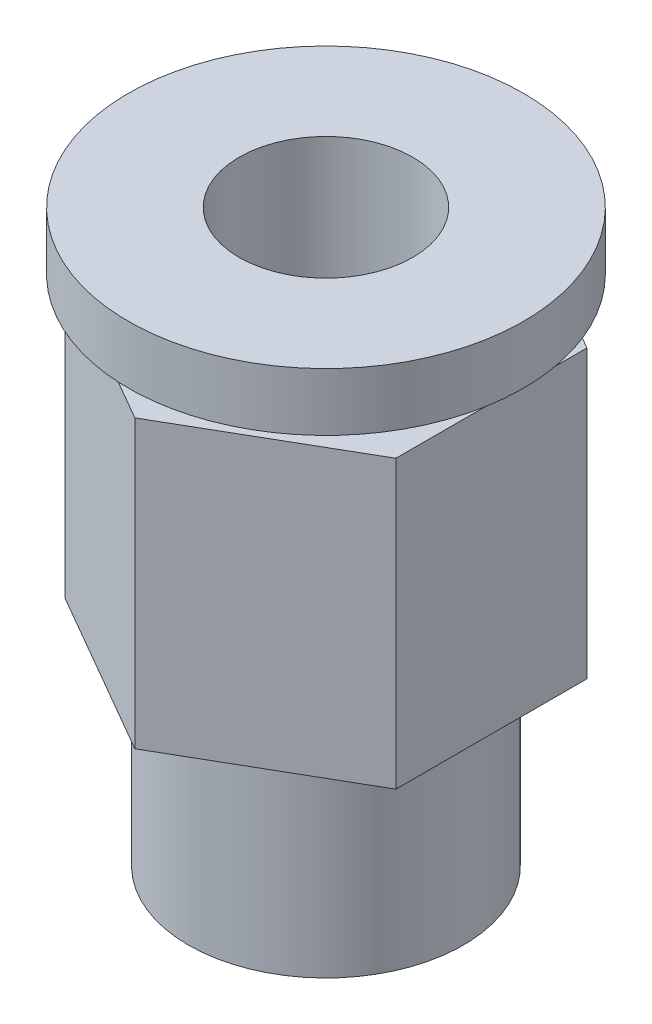
from build123d import *

# Parameters (mm, degrees)
CUT_EXTRUDE1_REACH = 18.111


with BuildPart() as part:
    # Sketch1 → Revolve1 (revolve)
    with BuildSketch(Plane.XY, mode=Mode.PRIVATE) as revolve1_sk:
        Polygon((-4.75, 0), (-4.75, 6.8), (-6.6, 6.8), (-6.6, 16.7), (-4, 16.7), (-4, 17.7), (-6.825, 17.7), (-6.825, 19.7), (-3, 19.7), (-3, 0), align=None)
    revolve(revolve1_sk.sketch.rotate(Axis((0, 0, 0), (0, 1, 0)), 270), axis=Axis((0, 0, 0), (0, 1, 0)))

    # Sketch2 → Cut-Extrude1 (cut, up to next)
    with BuildSketch(Plane.XZ.offset(-6.8), mode=Mode.PRIVATE) as cut_extrude1_sk1:
        with BuildLine():
            Line((-5.715767665, 3.3), (0, 6.6))
            ThreePointArc((0, 6.6), (-3.3, 5.715767665), (-5.715767665, 3.3))
        make_face()
    cut_extrude1_tool1 = extrude(cut_extrude1_sk1.sketch, amount=-CUT_EXTRUDE1_REACH, mode=Mode.PRIVATE) & part.part
    # Sketch2 → Cut-Extrude1 (cut, up to next)
    with BuildSketch(Plane.XZ.offset(-6.8), mode=Mode.PRIVATE) as cut_extrude1_sk2:
        with BuildLine():
            ThreePointArc((5.715767665, 3.3), (3.3, 5.715767665), (0, 6.6))
            Line((0, 6.6), (5.715767665, 3.3))
        make_face()
    cut_extrude1_tool2 = extrude(cut_extrude1_sk2.sketch, amount=-CUT_EXTRUDE1_REACH, mode=Mode.PRIVATE) & part.part
    # Sketch2 → Cut-Extrude1 (cut, up to next)
    with BuildSketch(Plane.XZ.offset(-6.8), mode=Mode.PRIVATE) as cut_extrude1_sk3:
        with BuildLine():
            ThreePointArc((6.6, 0), (6.375110454, 1.708205698), (5.715767665, 3.3))
            Line((5.715767665, 3.3), (5.715767665, -3.3))
            ThreePointArc((5.715767665, -3.3), (6.375110454, -1.708205698), (6.6, 0))
        make_face()
    cut_extrude1_tool3 = extrude(cut_extrude1_sk3.sketch, amount=-CUT_EXTRUDE1_REACH, mode=Mode.PRIVATE) & part.part
    # Sketch2 → Cut-Extrude1 (cut, up to next)
    with BuildSketch(Plane.XZ.offset(-6.8), mode=Mode.PRIVATE) as cut_extrude1_sk4:
        with BuildLine():
            ThreePointArc((0, -6.6), (3.3, -5.715767665), (5.715767665, -3.3))
            Line((5.715767665, -3.3), (0, -6.6))
        make_face()
    cut_extrude1_tool4 = extrude(cut_extrude1_sk4.sketch, amount=-CUT_EXTRUDE1_REACH, mode=Mode.PRIVATE) & part.part
    # Sketch2 → Cut-Extrude1 (cut, up to next)
    with BuildSketch(Plane.XZ.offset(-6.8), mode=Mode.PRIVATE) as cut_extrude1_sk5:
        with BuildLine():
            Line((0, -6.6), (-5.715767665, -3.3))
            ThreePointArc((-5.715767665, -3.3), (-3.3, -5.715767665), (0, -6.6))
        make_face()
    cut_extrude1_tool5 = extrude(cut_extrude1_sk5.sketch, amount=-CUT_EXTRUDE1_REACH, mode=Mode.PRIVATE) & part.part
    # Sketch2 → Cut-Extrude1 (cut, up to next)
    with BuildSketch(Plane.XZ.offset(-6.8), mode=Mode.PRIVATE) as cut_extrude1_sk6:
        with BuildLine():
            Line((-5.715767665, -3.3), (-5.715767665, 3.3))
            ThreePointArc((-5.715767665, 3.3), (-6.6, 0), (-5.715767665, -3.3))
        make_face()
    cut_extrude1_tool6 = extrude(cut_extrude1_sk6.sketch, amount=-CUT_EXTRUDE1_REACH, mode=Mode.PRIVATE) & part.part
    add(cut_extrude1_tool1.solids().sort_by_distance((-3.035787, 6.8, 5.258137))[0], mode=Mode.SUBTRACT)
    add(cut_extrude1_tool2.solids().sort_by_distance((3.035787, 6.8, 5.258137))[0], mode=Mode.SUBTRACT)
    add(cut_extrude1_tool3.solids().sort_by_distance((6.071573, 6.8, 0))[0], mode=Mode.SUBTRACT)
    add(cut_extrude1_tool4.solids().sort_by_distance((3.035787, 6.8, -5.258137))[0], mode=Mode.SUBTRACT)
    add(cut_extrude1_tool5.solids().sort_by_distance((-3.035787, 6.8, -5.258137))[0], mode=Mode.SUBTRACT)
    add(cut_extrude1_tool6.solids().sort_by_distance((-6.071573, 6.8, 0))[0], mode=Mode.SUBTRACT)


solid = part.part
